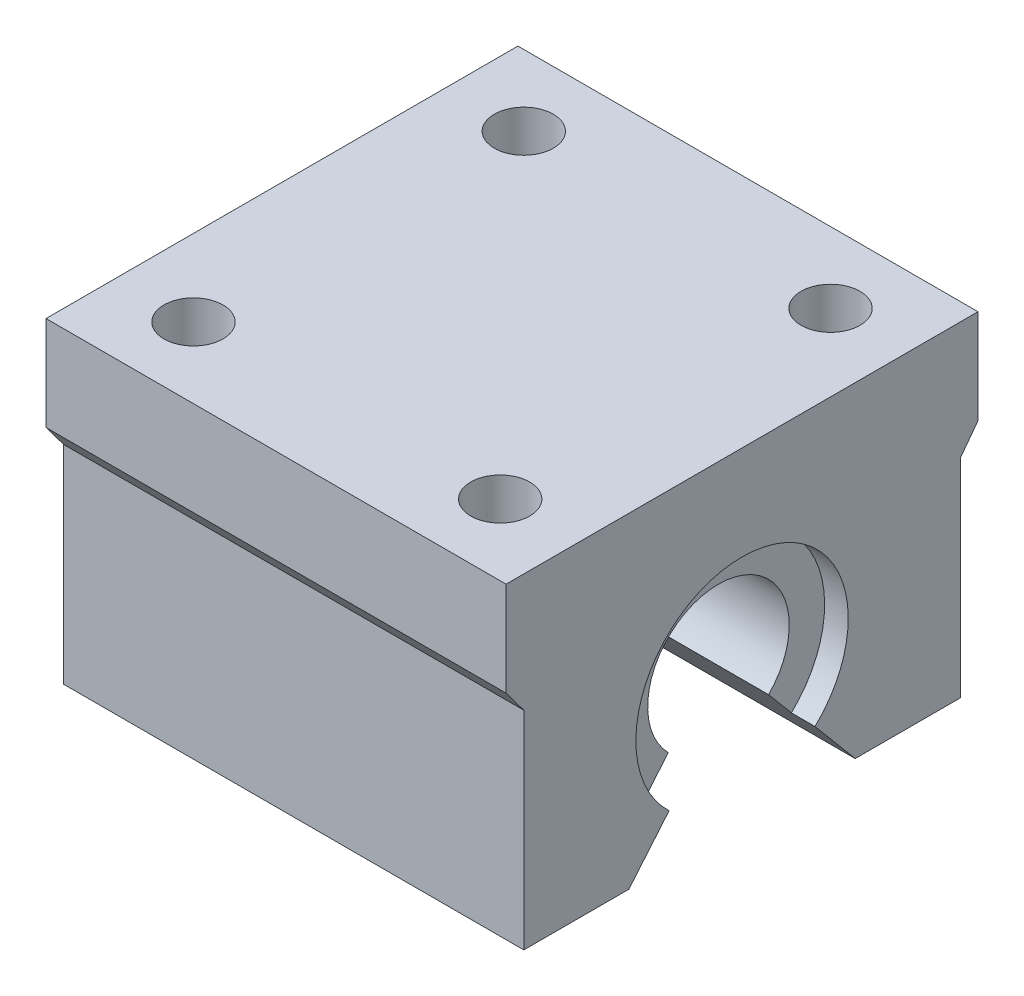
from build123d import *

# Parameters (mm, degrees)
EXTRUDE_1_DEPTH     = 39
SKETCH_3_R          = 9
CUT_EXTRUDE_1_DEPTH = 2
SKETCH_4_R          = 2.5
CUT_EXTRUDE_2_DEPTH = 10
CUT_EXTRUDE_4_DEPTH = 63.311796636


with BuildPart() as part:
    # 草图1 → 凸台-拉伸1 (new body)
    with BuildSketch(Plane(origin=(0, 0, 0), x_dir=(0, 0, -1), z_dir=(1, 0, 0))):
        with BuildLine():
            Line((0, 0), (10.409356218, 0))
            Line((10.409356218, 0), (15.75, 6.364731413))
            ThreePointArc((15.75, 6.364731413), (20, 16.6), (24.25, 6.364731413))
            Line((24.25, 6.364731413), (29.590643782, 0))
            Line((29.590643782, 0), (40, 0))
            Line((40, 0), (40, 27.6))
            Line((40, 27.6), (0, 27.6))
            Line((0, 27.6), (0, 0))
        make_face()
    extrude(amount=EXTRUDE_1_DEPTH)

    # 草图3 → 切除-拉伸1 (cut)
    with BuildSketch(Plane.ZY):
        with Locations((-20, 10.6)):
            Circle(SKETCH_3_R)
    cut_extrude_1 = extrude(amount=-CUT_EXTRUDE_1_DEPTH, mode=Mode.SUBTRACT)

    # 镜向1: 切除-拉伸1 across plane
    add(cut_extrude_1.mirror(Plane(origin=(19.5, 0, 0), x_dir=(0, 0, 1), z_dir=(1, 0, 0))), mode=Mode.SUBTRACT)

    # 草图4 → 切除-拉伸2 (cut)
    with BuildSketch(Plane(origin=(0, 27.6, 0), x_dir=(1, 0, 0), z_dir=(0, 1, 0))):
        with Locations(Location((6.5, 6, 0), (0, 0, 270))):
            Circle(SKETCH_4_R)
        with Locations(Location((6.5, 34, 0), (0, 0, 90))):
            Circle(SKETCH_4_R)
        with Locations(Location((32.5, 6, 0), (0, 0, 90))):
            Circle(SKETCH_4_R)
        with Locations(Location((32.5, 34, 0), (0, 0, 270))):
            Circle(SKETCH_4_R)
    extrude(amount=-CUT_EXTRUDE_2_DEPTH, mode=Mode.SUBTRACT)

    # 草图5 → 切除-拉伸4 (cut, through all)
    with BuildSketch(Plane.ZY):
        Polygon((0, 0), (-1.5, 0), (-1.5, 17.6), (0, 19.6), align=None)
        Polygon((-40, 19.6), (-40, 0), (-38.5, 0), (-38.5, 17.6), align=None)
    extrude(amount=-CUT_EXTRUDE_4_DEPTH, mode=Mode.SUBTRACT)


solid = part.part
